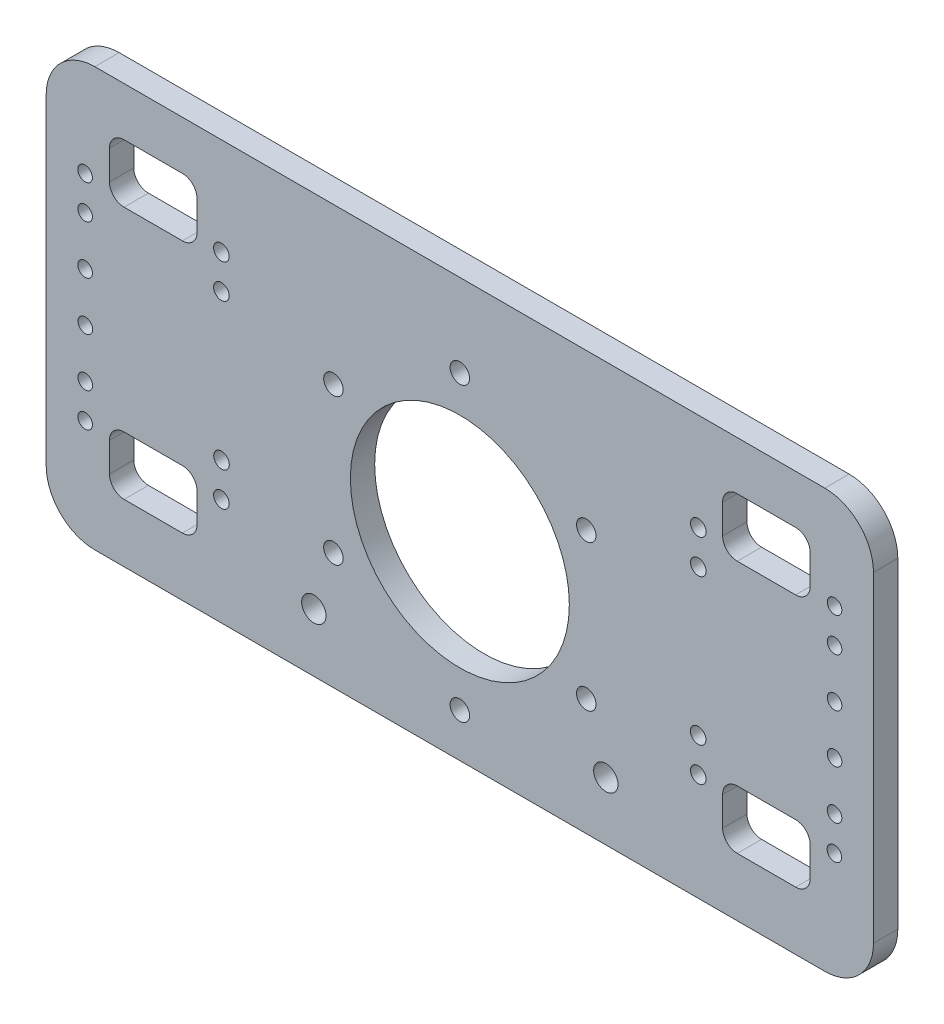
from build123d import *

# Parameters (mm, degrees)
SKETCH_1_W           = 170
SKETCH_1_H           = 100
EXTRUDE_1_DEPTH      = 5
SKETCH_3_R           = 1.5
CUT_EXTRUDE_2_DEPTH  = 99.742088291
SKETCH_5_R           = 22.5
CUT_EXTRUDE_4_DEPTH  = 99.742088291
SKETCH_6_W           = 170
SKETCH_6_H           = 6
CUT_EXTRUDE_5_DEPTH  = 99.742088291
SKETCH_7_R           = 2.5
CUT_EXTRUDE_6_DEPTH  = 99.742088291
SKETCH_8_W           = 170
SKETCH_8_H           = 18
CUT_EXTRUDE_7_DEPTH  = 10
SKETCH_9_W           = 18
SKETCH_9_H           = 12
CUT_EXTRUDE_9_DEPTH  = 10
SKETCH_10_W          = 18
SKETCH_10_H          = 12
CUT_EXTRUDE_10_DEPTH = 10
FILLET_3_R           = 3
SKETCH_11_W          = 170
SKETCH_11_H          = 5
EXTRUDE_2_DEPTH      = 10
FILLET_4_R           = 3
FILLET_5_R           = 10
SKETCH_12_R          = 1.6
CUT_EXTRUDE_11_DEPTH = 96.843622636
SKETCH_13_R          = 2
CUT_EXTRUDE_12_DEPTH = 17


with BuildPart() as part:
    # 草图1 → 凸台-拉伸1 (new body)
    with BuildSketch(Plane.XY):
        Rectangle(SKETCH_1_W, SKETCH_1_H)
    extrude(amount=EXTRUDE_1_DEPTH)

    # 草图3 → 切除-拉伸2 (cut, through all)
    with BuildSketch(Plane.XY.offset(5)):
        with Locations((-77, 22)):
            Circle(SKETCH_3_R)
        with Locations((-77, -22)):
            Circle(SKETCH_3_R)
        with Locations((77, 22)):
            Circle(SKETCH_3_R)
        with Locations((76.972177567, -21.999991204)):
            Circle(SKETCH_3_R)
        with Locations((-77, 15)):
            Circle(SKETCH_3_R)
        with Locations((-77, 5)):
            Circle(SKETCH_3_R)
        with Locations((-76.95458974, -4.999896895)):
            Circle(SKETCH_3_R)
        with Locations((-76.973665901, -14.9998787)):
            Circle(SKETCH_3_R)
        with Locations((77, 14.9999673)):
            Circle(SKETCH_3_R)
        with Locations((76.999998846, 4.9999673)):
            Circle(SKETCH_3_R)
        with Locations((77.000079735, -5.000032699)):
            Circle(SKETCH_3_R)
        with Locations((76.996042364, -15.000031884)):
            Circle(SKETCH_3_R)
    extrude(amount=-CUT_EXTRUDE_2_DEPTH, mode=Mode.SUBTRACT)

    # 草图5 → 切除-拉伸4 (cut, through all)
    with BuildSketch(Plane.XY.offset(5)):
        with Locations((0, -5)):
            Circle(SKETCH_5_R)
    extrude(amount=-CUT_EXTRUDE_4_DEPTH, mode=Mode.SUBTRACT)

    # 草图6 → 切除-拉伸5 (cut, through all)
    with BuildSketch(Plane.XY.offset(5)):
        with Locations((0, -47)):
            Rectangle(SKETCH_6_W, SKETCH_6_H)
    extrude(amount=-CUT_EXTRUDE_5_DEPTH, mode=Mode.SUBTRACT)

    # 草图7 → 切除-拉伸6 (cut, through all)
    with BuildSketch(Plane.XY.offset(5)):
        with Locations((30, -32)):
            Circle(SKETCH_7_R)
        with Locations((-30, -32)):
            Circle(SKETCH_7_R)
    extrude(amount=-CUT_EXTRUDE_6_DEPTH, mode=Mode.SUBTRACT)

    # 草图8 → 切除-拉伸7 (cut)
    with BuildSketch(Plane.XY.offset(5)):
        with Locations((0, 41)):
            Rectangle(SKETCH_8_W, SKETCH_8_H)
    extrude(amount=-CUT_EXTRUDE_7_DEPTH, mode=Mode.SUBTRACT)

    # 草图9 → 切除-拉伸9 (cut)
    with BuildSketch(Plane.XY.offset(5)):
        with Locations((-63, 26)):
            Rectangle(SKETCH_9_W, SKETCH_9_H)
        with Locations((63, 26)):
            Rectangle(SKETCH_9_W, SKETCH_9_H)
    extrude(amount=-CUT_EXTRUDE_9_DEPTH, mode=Mode.SUBTRACT)

    # 草图10 → 切除-拉伸10 (cut)
    with BuildSketch(Plane.XY.offset(5)):
        with Locations((-63, -26)):
            Rectangle(SKETCH_10_W, SKETCH_10_H)
        with Locations((63, -26)):
            Rectangle(SKETCH_10_W, SKETCH_10_H)
    extrude(amount=-CUT_EXTRUDE_10_DEPTH, mode=Mode.SUBTRACT)

    # 圆角3
    fillet_3_edges = [part.edges().sort_by_distance(p)[0] for p in [
        (-54, 20, 2.5),
        (-72, 20, 2.5),
        (54, 20, 2.5),
        (72, 20, 2.5),
        (-72, -32, 2.5),
        (-72, -20, 2.5),
        (-54, -20, 2.5),
        (-54, -32, 2.5),
        (72, -20, 2.5),
        (72, -32, 2.5),
        (54, -32, 2.5),
        (54, -20, 2.5),
    ]]
    fillet(fillet_3_edges, radius=FILLET_3_R)

    # 草图11 → 凸台-拉伸2 (add)
    with BuildSketch(Plane(origin=(0, 32, 0), x_dir=(1, 0, 0), z_dir=(0, 1, 0))):
        with Locations((0, -2.5)):
            Rectangle(SKETCH_11_W, SKETCH_11_H)
    extrude(amount=EXTRUDE_2_DEPTH)

    # 圆角4
    fillet_4_edges = [part.edges().sort_by_distance(p)[0] for p in [
        (-72, 32, 2.5),
        (-54, 32, 2.5),
        (54, 32, 2.5),
        (72, 32, 2.5),
    ]]
    fillet(fillet_4_edges, radius=FILLET_4_R)

    # 圆角5
    fillet_5_edges = [part.edges().sort_by_distance(p)[0] for p in [
        (-85, 42, 2.5),
        (85, 42, 2.5),
        (-85, -44, 2.5),
        (85, -44, 2.5),
    ]]
    fillet(fillet_5_edges, radius=FILLET_5_R)

    # 草图12 → 切除-拉伸11 (cut, through all)
    with BuildSketch(Plane.XY.offset(5)):
        with Locations((-49, 22)):
            Circle(SKETCH_12_R)
        with Locations((-49, 15)):
            Circle(SKETCH_12_R)
        with Locations((-48.973665901, -15)):
            Circle(SKETCH_12_R)
        with Locations((-49, -22)):
            Circle(SKETCH_12_R)
        with Locations((49, 22)):
            Circle(SKETCH_12_R)
        with Locations((49, 15)):
            Circle(SKETCH_12_R)
        with Locations((48.973665901, -15)):
            Circle(SKETCH_12_R)
        with Locations((49, -22)):
            Circle(SKETCH_12_R)
    extrude(amount=-CUT_EXTRUDE_11_DEPTH, mode=Mode.SUBTRACT)

    # 草图13 → 切除-拉伸12 (cut)
    with BuildSketch(Plane.XY.offset(5)):
        with Locations((25.980762114, 10)):
            Circle(SKETCH_13_R)
        with Locations((25.980762114, -20)):
            Circle(SKETCH_13_R)
        with Locations((0, 25)):
            Circle(SKETCH_13_R)
        with Locations((0, -35)):
            Circle(SKETCH_13_R)
        with Locations((-25.980762114, 10)):
            Circle(SKETCH_13_R)
        with Locations((-25.980762114, -20)):
            Circle(SKETCH_13_R)
    extrude(amount=-CUT_EXTRUDE_12_DEPTH, mode=Mode.SUBTRACT)


solid = part.part
